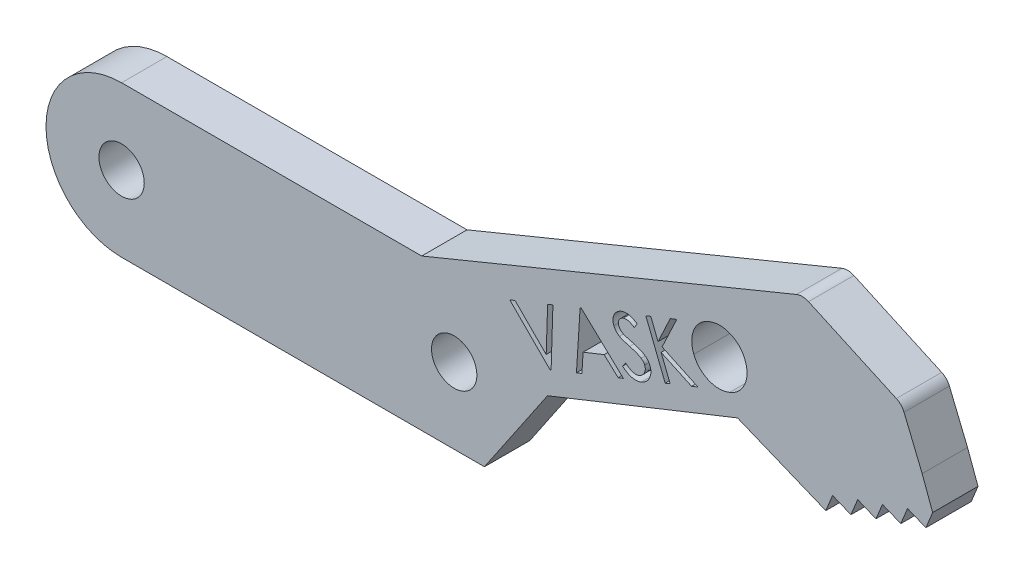
from build123d import *

# Parameters (mm, degrees)
SKETCH1_R           = 1.5
BOSS_EXTRUDE1_DEPTH = 3
CUT_EXTRUDE2_DEPTH  = 10


with BuildPart() as part:
    # Sketch1 → Boss-Extrude1 (new body)
    with BuildSketch(Plane.XY):
        with BuildLine():
            ThreePointArc((44.643069029, 15.193663072), (45.042006379, 15.268610471), (45.43786686, 15.178818479))
            Line((45.43786686, 15.178818479), (51.245085043, 12.533540635))
            ThreePointArc((51.245085043, 12.533540635), (51.550738574, 12.317286013), (51.755428853, 12.003770413))
            Line((51.755428853, 12.003770413), (52.954960556, 9.086264498))
            Line((52.954960556, 9.086264498), (53.647413738, 7.201821951))
            Line((53.647413738, 7.201821951), (53.200417763, 6.109762155))
            Line((53.200417763, 6.109762155), (51.987413738, 6.606262365))
            Line((51.987413738, 6.606262365), (51.540417763, 5.514202569))
            Line((51.540417763, 5.514202569), (50.327413738, 6.010702778))
            Line((50.327413738, 6.010702778), (49.901790908, 4.970859901))
            Line((49.901790908, 4.970859901), (48.688786884, 5.467360111))
            Line((48.688786884, 5.467360111), (48.241790908, 4.375300315))
            Line((48.241790908, 4.375300315), (47.028786884, 4.871800524))
            Line((47.028786884, 4.871800524), (46.581790908, 3.779740729))
            Line((46.581790908, 3.779740729), (40.742047423, 6.170032768))
            Line((40.742047423, 6.170032768), (28.174379319, 1.158584034))
            Line((28.174379319, 1.158584034), (24, -5))
            Line((24, -5), (22, -5))
            Line((22, -5), (0, -5))
            ThreePointArc((0, -5), (-5, 0), (0, 5))
            Line((0, 5), (19.85, 5))
            Line((19.85, 5), (44.643069029, 15.193663072))
        make_face()
        with Locations((22, 0)):
            Circle(SKETCH1_R, mode=Mode.SUBTRACT)
        Circle(SKETCH1_R, mode=Mode.SUBTRACT)
    extrude(amount=BOSS_EXTRUDE1_DEPTH)

    # Sketch2 → Cut-Extrude2 (cut)
    # profile 1 of 5: a face of its own
    with BuildSketch(Plane.XY.offset(3)):
        Polygon((25.67561959, 5.401591304), (26.026180488, 5.541114541), (28.084674077, 3.474908612), (28.180026642, 6.398586497), (28.530587539, 6.538109734), (28.411396834, 2.756959894), (28.341284654, 2.728915022), align=None)
    # profile 2 of 5: a face of its own
    with BuildSketch(Plane.XY.offset(3)):
        Polygon((30.406119311, 7.287330486), (33.191676202, 4.662330486), (32.846023157, 4.524910614), (31.917737901, 5.383784813), (30.528114503, 4.830599717), (30.446784375, 3.569281608), (30.087108894, 3.426252762), (30.326892548, 7.255780005), align=None)
        Polygon((30.638190625, 6.587610935), (30.549148157, 5.198688659), (31.651311619, 5.637590903), align=None, mode=Mode.SUBTRACT)
    # profile 3 of 5: a face of its own
    with BuildSketch(Plane.XY.offset(3)):
        with BuildLine():
            Line((33.134069211, 5.336405848), (33.343003506, 5.61054447))
            add(Edge.make_bspline(
                [(33.343003506, 5.61054447), (33.383607719, 5.578051113), (33.461428781, 5.515775123), (33.581489161, 5.43760165), (33.697652004, 5.377134206), (33.809964121, 5.333984733), (33.919021495, 5.308672067), (34.024592591, 5.301132725), (34.127067637, 5.311718648), (34.190958311, 5.333316604), (34.222911358, 5.344118188)],
                knots=[0, 0, 0, 0, 1.292257063, 2.476708882, 3.555068941, 4.542428406, 5.459970741, 6.327594326, 7.163595328, 8, 8, 8, 8], degree=3))
            add(Edge.make_bspline(
                [(34.222911358, 5.344118188), (34.249190199, 5.355611113), (34.301284685, 5.378394387), (34.373463932, 5.424240111), (34.439414373, 5.478134981), (34.498143206, 5.540107445), (34.5492223, 5.606841437), (34.588728468, 5.678655621), (34.618156777, 5.752762598), (34.635349009, 5.829423461), (34.642609708, 5.906540398), (34.638783987, 5.982883175), (34.625985783, 6.057834612), (34.609218048, 6.105493497), (34.600816006, 6.129374598)],
                knots=[0, 0, 0, 0, 1.06433076, 2.109901387, 3.164983108, 4.221314609, 5.275431201, 6.278194543, 7.256949104, 8.227970021, 9.187037774, 10.125805289, 11.060871151, 12, 12, 12, 12], degree=3))
            add(Edge.make_bspline(
                [(34.600816006, 6.129374598), (34.588925898, 6.155874757), (34.564883967, 6.209458373), (34.510088281, 6.2808593), (34.444974056, 6.348342469), (34.39236784, 6.384742111), (34.365239083, 6.40351322)],
                knots=[0, 0, 0, 0, 0.946513837, 1.913861496, 2.92418903, 4, 4, 4, 4], degree=3))
            add(Edge.make_bspline(
                [(34.365239083, 6.40351322), (34.344130555, 6.416642006), (34.299934784, 6.444130272), (34.226859767, 6.481821661), (34.145347809, 6.519218611), (34.054976055, 6.556788857), (33.95550699, 6.592635688), (33.847306992, 6.629188404), (33.730291751, 6.665802731), (33.648761639, 6.688405956), (33.606625301, 6.700087739)],
                knots=[0, 0, 0, 0, 0.729669835, 1.527739014, 2.412022148, 3.362721797, 4.400455672, 5.515875367, 6.716156377, 8, 8, 8, 8], degree=3))
            add(Edge.make_bspline(
                [(33.606625301, 6.700087739), (33.564728193, 6.711553361), (33.484677005, 6.733460282), (33.371326118, 6.768189465), (33.269275397, 6.800227465), (33.178761696, 6.830973007), (33.099974276, 6.860205447), (33.032550156, 6.887343577), (32.9771144, 6.913732215), (32.944677719, 6.932227649), (32.930042769, 6.940572515)],
                knots=[0, 0, 0, 0, 1.448433654, 2.767466368, 3.953022755, 5.015253688, 5.95477966, 6.755120608, 7.438328838, 8, 8, 8, 8], degree=3))
            add(Edge.make_bspline(
                [(32.930042769, 6.940572515), (32.908773847, 6.954021124), (32.866790519, 6.980567716), (32.808598596, 7.02583932), (32.754913628, 7.073932165), (32.707430764, 7.126695797), (32.662900102, 7.1807698), (32.623996932, 7.239019367), (32.590310019, 7.300560461), (32.571888054, 7.343787094), (32.562654948, 7.365452322)],
                knots=[0, 0, 0, 0, 1.055648753, 2.083774983, 3.090718009, 4.076559507, 5.06010454, 6.028664349, 7.011964762, 8, 8, 8, 8], degree=3))
            add(Edge.make_bspline(
                [(32.562654948, 7.365452322), (32.550275961, 7.400236855), (32.525834988, 7.468915157), (32.505640131, 7.575642713), (32.500066931, 7.682673939), (32.508302164, 7.789318288), (32.531311906, 7.893696775), (32.569109155, 7.993529985), (32.620026673, 8.08846769), (32.684467586, 8.176836887), (32.760045734, 8.257748342), (32.846293014, 8.327713739), (32.940615759, 8.38870438), (33.00949087, 8.418760531), (33.044325621, 8.433961938)],
                knots=[0, 0, 0, 0, 1.015877596, 2.005740604, 2.97920168, 3.960781874, 4.943248333, 5.912977004, 6.892274549, 7.90184991, 8.917482696, 9.933013461, 10.954586623, 12, 12, 12, 12], degree=3))
            add(Edge.make_bspline(
                [(33.044325621, 8.433961938), (33.082371038, 8.447295045), (33.157734482, 8.473706345), (33.275420129, 8.496540575), (33.394989604, 8.501384288), (33.495989412, 8.494203655), (33.578647984, 8.479393993), (33.644166246, 8.462216707), (33.712750607, 8.439720441), (33.784684498, 8.411542158), (33.859187379, 8.376833471), (33.937463383, 8.337821578), (34.017859694, 8.291729308), (34.072240564, 8.258796027), (34.100215044, 8.241854566)],
                knots=[0, 0, 0, 0, 1.295656293, 2.566540967, 3.838425769, 5.135128457, 5.814914165, 6.536949111, 7.311947506, 8.135588632, 9.020296555, 9.954922072, 10.947975799, 12, 12, 12, 12], degree=3))
            Line((34.100215044, 8.241854566), (33.916521134, 7.937567707))
            add(Edge.make_bspline(
                [(33.916521134, 7.937567707), (33.894146485, 7.950992451), (33.850866148, 7.976960566), (33.787231114, 8.012864084), (33.726775014, 8.043746619), (33.670124561, 8.070249574), (33.617549237, 8.093215591), (33.568250784, 8.110613452), (33.522969843, 8.124359591), (33.467795796, 8.135309155), (33.401574791, 8.142191722), (33.323048066, 8.138273911), (33.245055391, 8.124612588), (33.195099817, 8.107023317), (33.169826422, 8.098124598)],
                knots=[0, 0, 0, 0, 1.179603423, 2.281762402, 3.302413361, 4.247715304, 5.109240631, 5.894577567, 6.610073069, 7.246200155, 8.435229244, 9.609188485, 10.790446829, 12, 12, 12, 12], degree=3))
            add(Edge.make_bspline(
                [(33.169826422, 8.098124598), (33.139375788, 8.084167681), (33.080453118, 8.05716073), (33.002930612, 8.001116886), (32.941574803, 7.932059226), (32.895237196, 7.854023662), (32.866630138, 7.769612542), (32.854533578, 7.683101729), (32.862456745, 7.595394871), (32.88119769, 7.539741344), (32.890779948, 7.511285656)],
                knots=[0, 0, 0, 0, 1.10580473, 2.139757329, 3.13567727, 4.140193179, 5.120066635, 6.063177777, 7.009701421, 8, 8, 8, 8], degree=3))
            add(Edge.make_bspline(
                [(32.890779948, 7.511285656), (32.898047915, 7.494000895), (32.912519582, 7.459584212), (32.942284528, 7.411750146), (32.975594497, 7.366110602), (33.015080943, 7.322782298), (33.062722811, 7.282622749), (33.119911964, 7.244679041), (33.186451135, 7.207547581), (33.235310402, 7.185582545), (33.260972256, 7.174046072)],
                knots=[0, 0, 0, 0, 0.871588331, 1.735469677, 2.614562804, 3.500095278, 4.457126075, 5.507215514, 6.690740233, 8, 8, 8, 8], degree=3))
            add(Edge.make_bspline(
                [(33.260972256, 7.174046072), (33.270048687, 7.170433206), (33.291902182, 7.16173444), (33.331483276, 7.149722445), (33.382416474, 7.134280394), (33.444845422, 7.116126136), (33.518479731, 7.095155948), (33.603414551, 7.071053031), (33.700311906, 7.045391934), (33.768817754, 7.027275598), (33.805042769, 7.017695912)],
                knots=[0, 0, 0, 0, 0.413887273, 0.996524195, 1.751720949, 2.670124208, 3.751780166, 4.996716843, 6.411902345, 8, 8, 8, 8], degree=3))
            add(Edge.make_bspline(
                [(33.805042769, 7.017695912), (33.848800651, 7.005739938), (33.933565417, 6.982579646), (34.055581471, 6.945785107), (34.168076151, 6.906818601), (34.27194159, 6.868006377), (34.36678625, 6.827464376), (34.452319053, 6.78535259), (34.52923696, 6.74289533), (34.597200807, 6.698263061), (34.658155326, 6.651880358), (34.714436782, 6.604713831), (34.764978702, 6.554288929), (34.811627462, 6.502892508), (34.852006198, 6.448331505), (34.889131462, 6.392873858), (34.920602088, 6.33479751), (34.937886873, 6.294510145), (34.946469051, 6.27450681)],
                knots=[0, 0, 0, 0, 1.539209718, 2.981651398, 4.323351465, 5.578224699, 6.743420624, 7.821574314, 8.812116167, 9.722705924, 10.577584522, 11.410214985, 12.212104162, 12.99843196, 13.762902338, 14.512922376, 15.261641642, 16, 16, 16, 16], degree=3))
            add(Edge.make_bspline(
                [(34.946469051, 6.27450681), (34.957114452, 6.245481991), (34.978190473, 6.188017962), (34.999138759, 6.099145784), (35.010544531, 6.009834141), (35.011742737, 5.920039077), (35.003986608, 5.830090926), (34.987063065, 5.739607759), (34.9600781, 5.648788726), (34.923901278, 5.558788808), (34.880006909, 5.471803663), (34.829815956, 5.389651806), (34.770942495, 5.315352149), (34.706249675, 5.246716569), (34.634527742, 5.18502512), (34.55607652, 5.129724288), (34.470277699, 5.082076968), (34.409419369, 5.055906087), (34.378560397, 5.042635816)],
                knots=[0, 0, 0, 0, 0.984430869, 1.948999795, 2.902261795, 3.848164843, 4.804911211, 5.774755431, 6.776249345, 7.818954222, 8.861393123, 9.878138045, 10.880738889, 11.876345532, 12.879582306, 13.889897697, 14.930046399, 16, 16, 16, 16], degree=3))
            add(Edge.make_bspline(
                [(34.378560397, 5.042635816), (34.354138547, 5.033420018), (34.305833528, 5.0151917), (34.231842728, 4.993899178), (34.157376762, 4.979612951), (34.082962351, 4.969440963), (34.008184418, 4.965287168), (33.933190093, 4.966677528), (33.857972245, 4.973765006), (33.782451013, 4.986362088), (33.706025739, 5.00557577), (33.628414735, 5.031494566), (33.549220151, 5.064815938), (33.469021345, 5.105773089), (33.38673195, 5.1527827), (33.303076242, 5.206946218), (33.218519189, 5.268776441), (33.162646701, 5.313520363), (33.134069211, 5.336405848)],
                knots=[0, 0, 0, 0, 0.92743749, 1.834418156, 2.731918193, 3.619952907, 4.501751346, 5.390601323, 6.283168733, 7.184350523, 8.108957274, 9.080743098, 10.089552233, 11.159293966, 12.279097631, 13.456320808, 14.698966689, 16, 16, 16, 16], degree=3))
        make_face()
    # profile 4 of 5: a face of its own
    with BuildSketch(Plane.XY.offset(3)):
        Polygon((34.673865381, 8.990011986), (35.002691503, 9.12042064), (35.484362176, 7.910985543), (36.289249997, 9.632940672), (36.724646631, 9.806117755), (35.75148958, 7.743417434), (38.128292465, 6.631438268), (37.701309292, 6.461065672), (35.686986375, 7.400568877), (36.285744388, 5.897363749), (35.956918266, 5.766955095), align=None)
    # profile 5 of 5: a face of its own
    with BuildSketch(Plane.XY.offset(3)):
        with BuildLine():
            add(Edge.make_bspline(
                [(38.845307833, 10.746419711), (38.905695858, 10.768848643), (39.024410554, 10.812940892), (39.206335158, 10.858210719), (39.386568156, 10.885996955), (39.565627257, 10.895576886), (39.743175751, 10.885155726), (39.919546955, 10.858214284), (40.093984409, 10.810961204), (40.265528974, 10.747841819), (40.429766791, 10.668100054), (40.584196927, 10.575897677), (40.725278823, 10.46921223), (40.853668261, 10.34945535), (40.969118061, 10.215911758), (41.072554444, 10.069619026), (41.16295602, 9.909797335), (41.211497387, 9.795974208), (41.236133154, 9.73820657)],
                knots=[0, 0, 0, 0, 1.066998418, 2.097574696, 3.100617146, 4.08575962, 5.063372622, 6.043445746, 7.037495486, 8.053468104, 9.068665122, 10.059123698, 11.029813647, 11.994480017, 12.963746915, 13.950319956, 14.959744152, 16, 16, 16, 16], degree=3))
            add(Edge.make_bspline(
                [(41.236133154, 9.73820657), (41.257878669, 9.679690169), (41.300687067, 9.564494306), (41.343771496, 9.387422492), (41.369593764, 9.211345974), (41.376396229, 9.035591647), (41.366078423, 8.860315126), (41.336978849, 8.685541312), (41.289646713, 8.511540283), (41.224541078, 8.340755563), (41.145440453, 8.175916755), (41.052141534, 8.021981254), (40.945686379, 7.880610571), (40.825858111, 7.752525278), (40.693329452, 7.636996351), (40.548127995, 7.534072097), (40.389544824, 7.444499596), (40.276785074, 7.395904315), (40.219506551, 7.371219391)],
                knots=[0, 0, 0, 0, 1.04368272, 2.054602322, 3.042197313, 4.016584245, 4.991951331, 5.974805647, 6.975487844, 8.003800888, 9.028591727, 10.030434384, 11.010297552, 11.984080218, 12.959557021, 13.946811382, 14.957042638, 16, 16, 16, 16], degree=3))
            add(Edge.make_bspline(
                [(40.219506551, 7.371219391), (40.160284827, 7.349257485), (40.04389359, 7.30609472), (39.86502175, 7.262090842), (39.687286179, 7.235701864), (39.51016438, 7.228215379), (39.334087191, 7.237455622), (39.159030057, 7.267198198), (38.98465924, 7.313313718), (38.813502856, 7.377792781), (38.649117105, 7.456926113), (38.495499137, 7.54978577), (38.354388304, 7.655054079), (38.227185773, 7.774031681), (38.110817511, 7.903685432), (38.010522432, 8.048296226), (37.919666495, 8.203461435), (37.872349593, 8.315038914), (37.848312641, 8.371720192)],
                knots=[0, 0, 0, 0, 1.057170484, 2.077706836, 3.078536349, 4.061946447, 5.04203249, 6.02593322, 7.030445271, 8.058475495, 9.084357397, 10.081890184, 11.060443058, 12.027063114, 12.994760379, 13.972153959, 14.96985568, 16, 16, 16, 16], degree=3))
            add(Edge.make_bspline(
                [(37.848312641, 8.371720192), (37.833851232, 8.410363421), (37.80510753, 8.487171254), (37.770008866, 8.604377284), (37.743020344, 8.722639049), (37.725454289, 8.841541761), (37.713492986, 8.960862747), (37.711090741, 9.080829985), (37.715942837, 9.20165662), (37.728564386, 9.322492178), (37.748569223, 9.442020588), (37.777049178, 9.558440919), (37.811213907, 9.671988846), (37.85304671, 9.782050928), (37.903586302, 9.888094136), (37.95950785, 9.99175868), (38.023252474, 10.091795661), (38.094289929, 10.187818981), (38.170890531, 10.27934191), (38.25312451, 10.364793947), (38.339549693, 10.444728112), (38.431525956, 10.517357031), (38.528044982, 10.584258352), (38.628761152, 10.645289732), (38.734705798, 10.699804091), (38.808167597, 10.730766155), (38.845307833, 10.746419711)],
                knots=[0, 0, 0, 0, 1.03657645, 2.060314145, 3.071834498, 4.081785278, 5.078692801, 6.083182266, 7.094105786, 8.115550144, 9.13410364, 10.136857774, 11.125166089, 12.1121999, 13.092097524, 14.074929533, 15.070331062, 16.069881555, 17.074439684, 18.067117715, 19.048000303, 20.030270714, 21.009323295, 21.997334955, 22.987508416, 24, 24, 24, 24], degree=3))
        make_face()
        with BuildLine():
            add(Edge.make_bspline(
                [(38.986233314, 10.437225), (38.956848875, 10.424743694), (38.898401599, 10.399917686), (38.814022492, 10.356173162), (38.733434025, 10.307209664), (38.656451509, 10.252462466), (38.582139267, 10.193394958), (38.511865062, 10.127734817), (38.445403694, 10.056777829), (38.382246263, 9.981455113), (38.324895161, 9.901816269), (38.271279511, 9.820341347), (38.225763152, 9.735408605), (38.184353873, 9.648951039), (38.15032185, 9.559981818), (38.121913509, 9.468658152), (38.09982575, 9.375127756), (38.082796927, 9.27966907), (38.072162647, 9.183172505), (38.068855813, 9.086170504), (38.071619818, 8.989450901), (38.080721733, 8.892444673), (38.096921885, 8.795511069), (38.119558456, 8.698387135), (38.148117331, 8.601357029), (38.172061766, 8.537747414), (38.184149981, 8.505634455)],
                knots=[0, 0, 0, 0, 0.988025554, 1.965237552, 2.93925731, 3.904776075, 4.887782531, 5.875781596, 6.878948574, 7.896054493, 8.916269146, 9.915646087, 10.912820831, 11.896678882, 12.881520671, 13.858652321, 14.855380791, 15.854522014, 16.858810185, 17.857872824, 18.856699672, 19.852324722, 20.871641128, 21.896539505, 22.938079685, 24, 24, 24, 24], degree=3))
            add(Edge.make_bspline(
                [(38.184149981, 8.505634455), (38.204079284, 8.459174771), (38.243288225, 8.36776992), (38.316414402, 8.239462042), (38.398947646, 8.121327176), (38.492201021, 8.013894182), (38.595805909, 7.91724504), (38.710200171, 7.831696902), (38.833813696, 7.755498225), (38.966492063, 7.691640939), (39.104286094, 7.640130856), (39.243873446, 7.601871109), (39.383902579, 7.578620854), (39.523890579, 7.569234912), (39.664446893, 7.574934806), (39.804797775, 7.595663395), (39.945579494, 7.62986103), (40.037034292, 7.663385358), (40.083488923, 7.680414102)],
                knots=[0, 0, 0, 0, 1.051690439, 2.06909732, 3.067897291, 4.047314255, 5.024917056, 6.011557311, 7.01616994, 8.043197548, 9.071560963, 10.074723585, 11.051296865, 12.021511521, 12.99044456, 13.973636295, 14.970704852, 16, 16, 16, 16], degree=3))
            add(Edge.make_bspline(
                [(40.083488923, 7.680414102), (40.114253684, 7.693399583), (40.175161939, 7.719108315), (40.263298264, 7.763296134), (40.346792862, 7.813533302), (40.426811894, 7.867788625), (40.502340919, 7.928224702), (40.57419392, 7.992872722), (40.642081099, 8.062950559), (40.705369855, 8.1375601), (40.764070548, 8.215647501), (40.817046255, 8.296536337), (40.863326774, 8.380360174), (40.903882161, 8.466288237), (40.938683392, 8.554483281), (40.966517982, 8.645301566), (40.98911467, 8.738433165), (41.005138791, 8.83380121), (41.014876661, 8.930064792), (41.018464438, 9.026792216), (41.015552198, 9.123507075), (41.006730782, 9.220316639), (40.990123499, 9.31695003), (40.967836794, 9.413449605), (40.938985728, 9.510162223), (40.915165552, 9.573575063), (40.903100301, 9.605694551)],
                knots=[0, 0, 0, 0, 1.029779327, 2.038763185, 3.037603123, 4.033264938, 5.018276535, 6.018571903, 7.012588578, 8.025068009, 9.034206339, 10.023848853, 11.004711011, 11.984937313, 12.952707746, 13.926232476, 14.912272118, 15.906497851, 16.906325633, 17.894497027, 18.88963687, 19.888762864, 20.890096529, 21.911211663, 22.941999588, 24, 24, 24, 24], degree=3))
            add(Edge.make_bspline(
                [(40.903100301, 9.605694551), (40.889907452, 9.637171618), (40.863865014, 9.699306763), (40.818942698, 9.788719646), (40.768462937, 9.872947029), (40.715364153, 9.954091355), (40.654674456, 10.028893216), (40.591396777, 10.100859025), (40.522406422, 10.167306758), (40.449393491, 10.229210946), (40.372462567, 10.28575972), (40.292381048, 10.337064323), (40.209331671, 10.382958045), (40.123008246, 10.422728531), (40.033938801, 10.457442488), (39.941395024, 10.485130242), (39.846292354, 10.508696568), (39.748492899, 10.524963191), (39.649993077, 10.53643745), (39.551859267, 10.541316613), (39.454667514, 10.539954638), (39.358634933, 10.532260054), (39.263753952, 10.518258635), (39.170116943, 10.497696595), (39.077258063, 10.47128469), (39.016707391, 10.448627806), (38.986233314, 10.437225)],
                knots=[0, 0, 0, 0, 1.056749275, 2.086003417, 3.095111438, 4.096743228, 5.085744922, 6.075037861, 7.062847204, 8.048825475, 9.03748286, 10.017199196, 10.992199405, 11.973331498, 12.95851259, 13.949815429, 14.9626538, 15.990660376, 17.017672908, 18.03216481, 19.031021193, 20.025726276, 21.013429563, 21.998610655, 22.992736333, 24, 24, 24, 24], degree=3))
        make_face(mode=Mode.SUBTRACT)
    extrude(amount=-CUT_EXTRUDE2_DEPTH, mode=Mode.SUBTRACT)


with BuildPart() as cut_extrude2_kept_piece:
    # of the separate pieces the step leaves, the one the design keeps (cut_extrude2_pieces_kept)
    add(part.part.solids().sort_by_distance((44.643069029, 15.193663072, 0))[0])


solid = cut_extrude2_kept_piece.part
